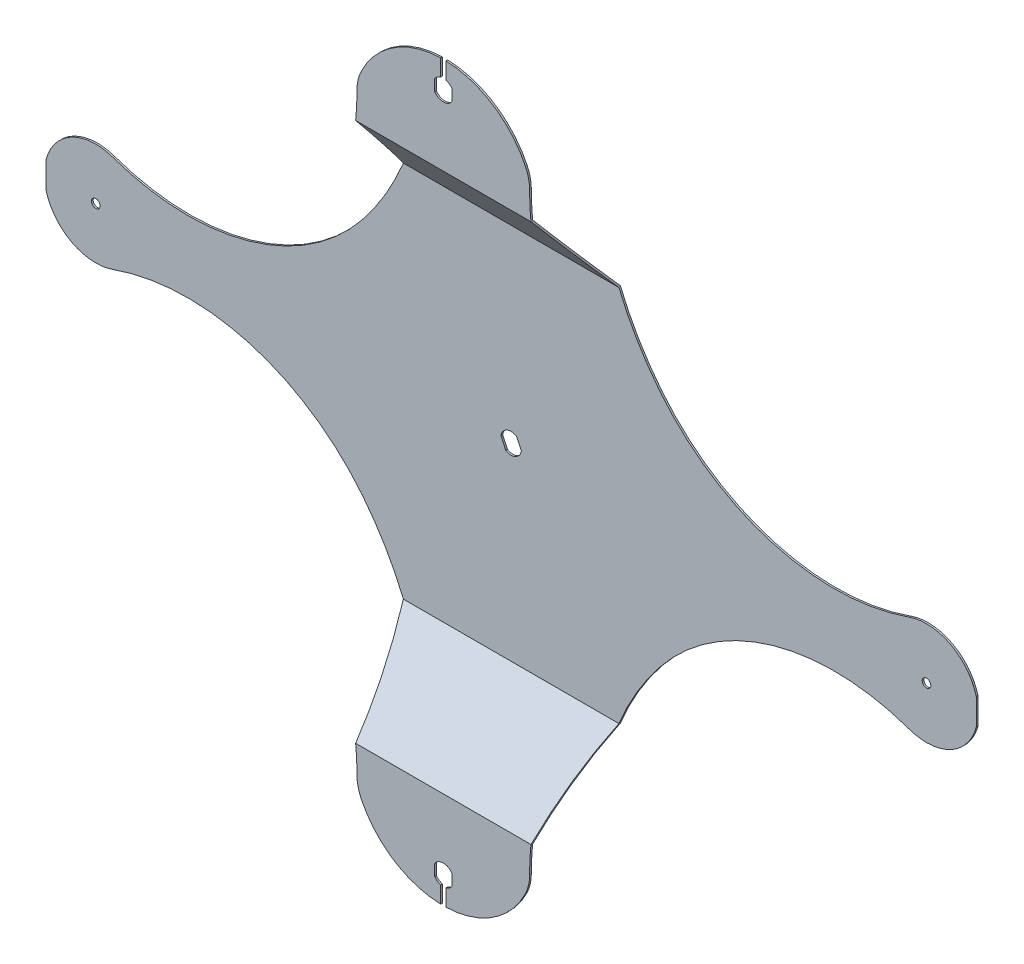
from build123d import *

# Parameters (mm, degrees)
SALIENTE_EXTRUIR1_DEPTH     = 271
CORTAR_EXTRUIR9_DEPTH       = 372.904084134
CORTAR_EXTRUIR9_DEPTH_BACK  = 372.904084134
CROQUIS4_R                  = 2.5
CORTAR_EXTRUIR10_DEPTH      = 372.904084134
CORTAR_EXTRUIR10_DEPTH_BACK = 372.904084134
CROQUIS2_W                  = 600.899293422
CROQUIS2_H                  = 554.061756016


with BuildPart() as part:
    # Croquis1 → Saliente-Extruir1 (new, symmetric)
    with BuildSketch(Plane(origin=(0, 0, 0), x_dir=(0, 0, -1), z_dir=(1, 0, 0))):
        Polygon((-18.5, -110), (-18.5, 110), (-58.031437996, 157.111733252), (-58.031437996, 248), (-57.031437996, 248), (-57.031437996, 157.475703486), (-17.5, 110.363970234), (-17.5, -110.363970234), (-57.031437996, -157.475703486), (-57.031437996, -248), (-58.031437996, -248), (-58.031437996, -157.111733252), align=None)
    extrude(amount=SALIENTE_EXTRUIR1_DEPTH, both=True)

    # Croquis4 → Cortar-Extruir9 (cut, two sides: drawn at the far end of the back side and taken through both)
    with BuildSketch(Plane.XY.offset(-CORTAR_EXTRUIR9_DEPTH_BACK)):
        with Locations(Location((-242, 0, 0), (0, 0, 90))):
            Circle(CROQUIS4_R)
        with Locations(Location((242, 0, 0), (0, 0, 90))):
            Circle(CROQUIS4_R)
        with BuildLine():
            Line((-5, 201.31662479), (-5, 194.68337521))
            ThreePointArc((-5, 194.68337521), (0, 192), (5, 194.68337521))
            Line((5, 194.68337521), (5, 201.31662479))
            ThreePointArc((5, 201.31662479), (0, 204), (-5, 201.31662479))
        make_face()
        with BuildLine():
            Line((5, -201.31662479), (5, -194.68337521))
            ThreePointArc((5, -194.68337521), (0, -192), (-5, -194.68337521))
            Line((-5, -194.68337521), (-5, -201.31662479))
            ThreePointArc((-5, -201.31662479), (0, -204), (5, -201.31662479))
        make_face()
        with BuildLine():
            Line((-5.933205139, 0.892791565), (-3.129872731, -5.118974183))
            ThreePointArc((-3.129872731, -5.118974183), (2.53570957, -5.437846722), (5.933205139, -0.892791565))
            Line((5.933205139, -0.892791565), (3.129872731, 5.118974183))
            ThreePointArc((3.129872731, 5.118974183), (-2.53570957, 5.437846722), (-5.933205139, 0.892791565))
        make_face()
    extrude(amount=CORTAR_EXTRUIR9_DEPTH + CORTAR_EXTRUIR9_DEPTH_BACK, mode=Mode.SUBTRACT)

    # Croquis2 → Cortar-Extruir10 (cut, two sides: drawn at the far end of the back side and taken through both)
    with BuildSketch(Plane.XY.offset(-CORTAR_EXTRUIR10_DEPTH_BACK)):
        Rectangle(CROQUIS2_W, CROQUIS2_H)
        with BuildLine():
            Line((1.5, 198), (1.5, 213.5))
            ThreePointArc((1.5, 213.5), (28.875083063, 204.989128333), (47.85, 183.5))
            ThreePointArc((47.85, 183.5), (49.675606578, 178.308038097), (50.3, 172.84))
            ThreePointArc((50.3, 172.84), (59.704263449, 118.077622514), (86.695218386, 69.509664861))
            ThreePointArc((86.695218386, 69.509664861), (152.735315328, 25.690942775), (231.948594909, 28.266044217))
            ThreePointArc((231.948594909, 28.266044217), (272, 0), (231.948594909, -28.266044217))
            ThreePointArc((231.948594909, -28.266044217), (152.735315328, -25.690942775), (86.695218386, -69.509664861))
            ThreePointArc((86.695218386, -69.509664861), (59.704263449, -118.077622514), (50.3, -172.84))
            ThreePointArc((50.3, -172.84), (49.675606578, -178.308038097), (47.85, -183.5))
            ThreePointArc((47.85, -183.5), (28.875083063, -204.989128333), (1.5, -213.5))
            Line((1.5, -213.5), (1.5, -198))
            Line((1.5, -198), (-1.5, -198))
            Line((-1.5, -198), (-1.5, -213.5))
            ThreePointArc((-1.5, -213.5), (-28.875083063, -204.989128333), (-47.85, -183.5))
            ThreePointArc((-47.85, -183.5), (-49.675606578, -178.308038097), (-50.3, -172.84))
            ThreePointArc((-50.3, -172.84), (-59.704263449, -118.077622514), (-86.695218386, -69.509664861))
            ThreePointArc((-86.695218386, -69.509664861), (-152.735315328, -25.690942775), (-231.948594909, -28.266044217))
            ThreePointArc((-231.948594909, -28.266044217), (-272, 0), (-231.948594909, 28.266044217))
            ThreePointArc((-231.948594909, 28.266044217), (-152.735315328, 25.690942775), (-86.695218386, 69.509664861))
            ThreePointArc((-86.695218386, 69.509664861), (-59.704263449, 118.077622514), (-50.3, 172.84))
            ThreePointArc((-50.3, 172.84), (-49.675606578, 178.308038097), (-47.85, 183.5))
            ThreePointArc((-47.85, 183.5), (-28.875083063, 204.989128333), (-1.5, 213.5))
            Line((-1.5, 213.5), (-1.5, 198))
            Line((-1.5, 198), (1.5, 198))
        make_face(mode=Mode.SUBTRACT)
    extrude(amount=CORTAR_EXTRUIR10_DEPTH + CORTAR_EXTRUIR10_DEPTH_BACK, mode=Mode.SUBTRACT)


solid = part.part
